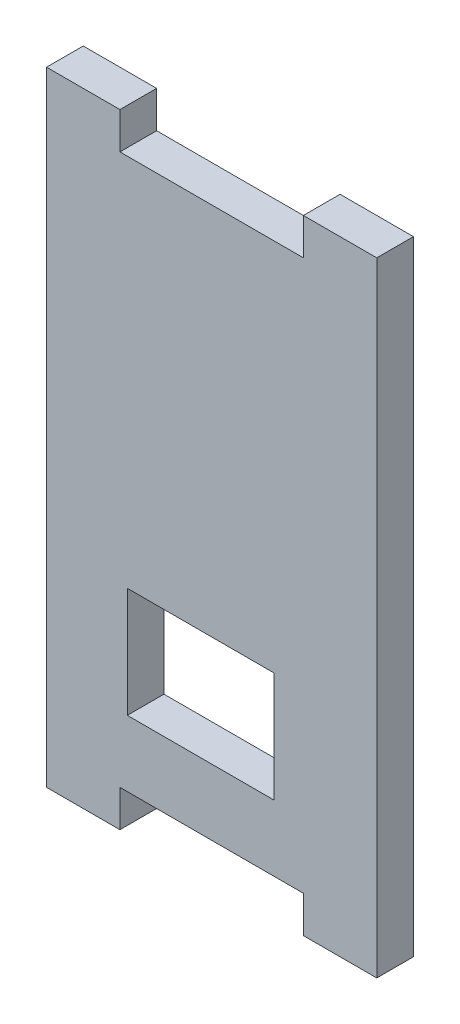
from build123d import *

# Parameters (mm, degrees)
ESQUISSE1_W        = 45
ESQUISSE1_H        = 75
ESQUISSE1_W_2      = 20
ESQUISSE1_H_2      = 15
BOSS_EXTRU_1_DEPTH = 5
ESQUISSE2_W        = 10
ESQUISSE2_H        = 5
BOSS_EXTRU_2_DEPTH = 5


with BuildPart() as part:
    # Esquisse1 → Boss.-Extru.1 (new body)
    with BuildSketch(Plane.XY):
        with Locations((22.5, 37.5)):
            Rectangle(ESQUISSE1_W, ESQUISSE1_H)
        with Locations((21, 16.5)):
            Rectangle(ESQUISSE1_W_2, ESQUISSE1_H_2, mode=Mode.SUBTRACT)
    extrude(amount=BOSS_EXTRU_1_DEPTH)

    # Esquisse2 → Boss.-Extru.2 (add)
    with BuildSketch(Plane.XY.offset(5)):
        with Locations((5, 77.5)):
            Rectangle(ESQUISSE2_W, ESQUISSE2_H)
        with Locations((40, 77.5)):
            Rectangle(ESQUISSE2_W, ESQUISSE2_H)
        with Locations((5, -2.5)):
            Rectangle(ESQUISSE2_W, ESQUISSE2_H)
        with Locations((40, -2.5)):
            Rectangle(ESQUISSE2_W, ESQUISSE2_H)
    extrude(amount=-BOSS_EXTRU_2_DEPTH)


solid = part.part
